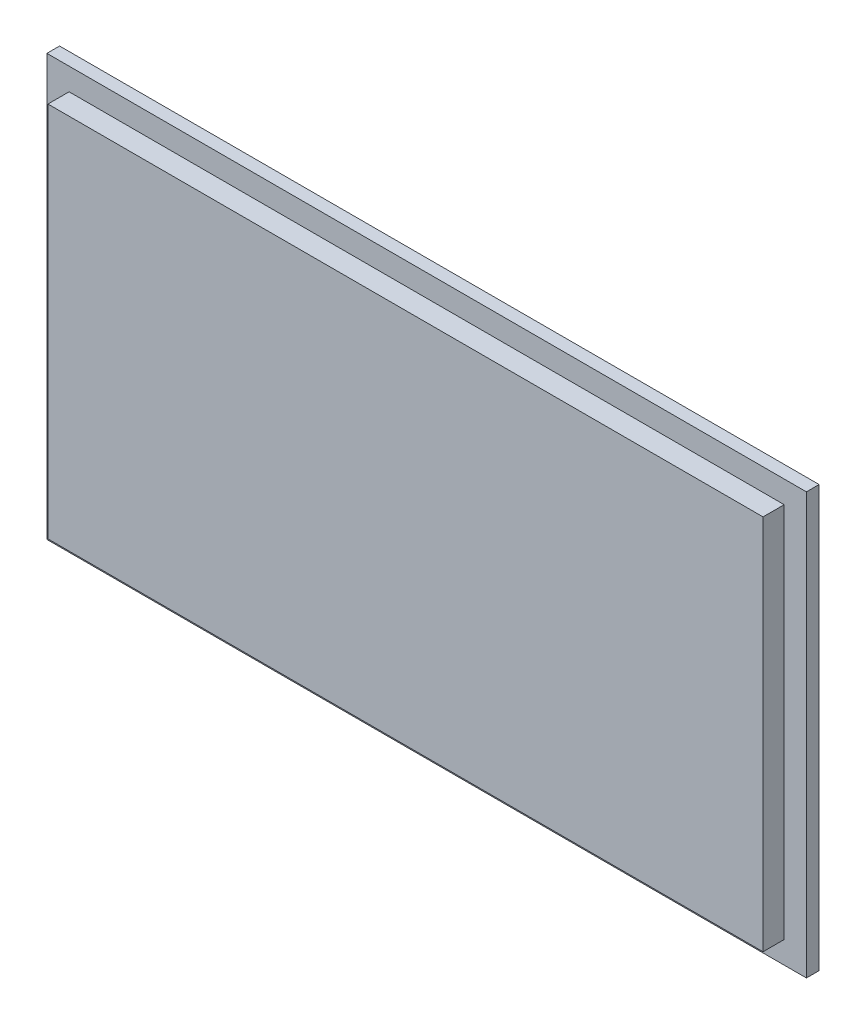
from build123d import *

# Parameters (mm, degrees)
SKICA1_W                = 179.5
SKICA1_H                = 99.5
P_IDAT_VYSUNUT_M2_DEPTH = 3
SKICA2_W                = 169
SKICA2_H                = 89
P_IDAT_VYSUNUT_M3_DEPTH = 5


with BuildPart() as part:
    # Skica1 → Přidat vysunutím2 (new body)
    with BuildSketch(Plane.XY):
        with Locations((89.75, 49.75)):
            Rectangle(SKICA1_W, SKICA1_H)
    extrude(amount=P_IDAT_VYSUNUT_M2_DEPTH)

    # Skica2 → Přidat vysunutím3 (add)
    with BuildSketch(Plane.XY.offset(3)):
        with Locations((89.75, 49.75)):
            Rectangle(SKICA2_W, SKICA2_H)
    extrude(amount=P_IDAT_VYSUNUT_M3_DEPTH)


solid = part.part
